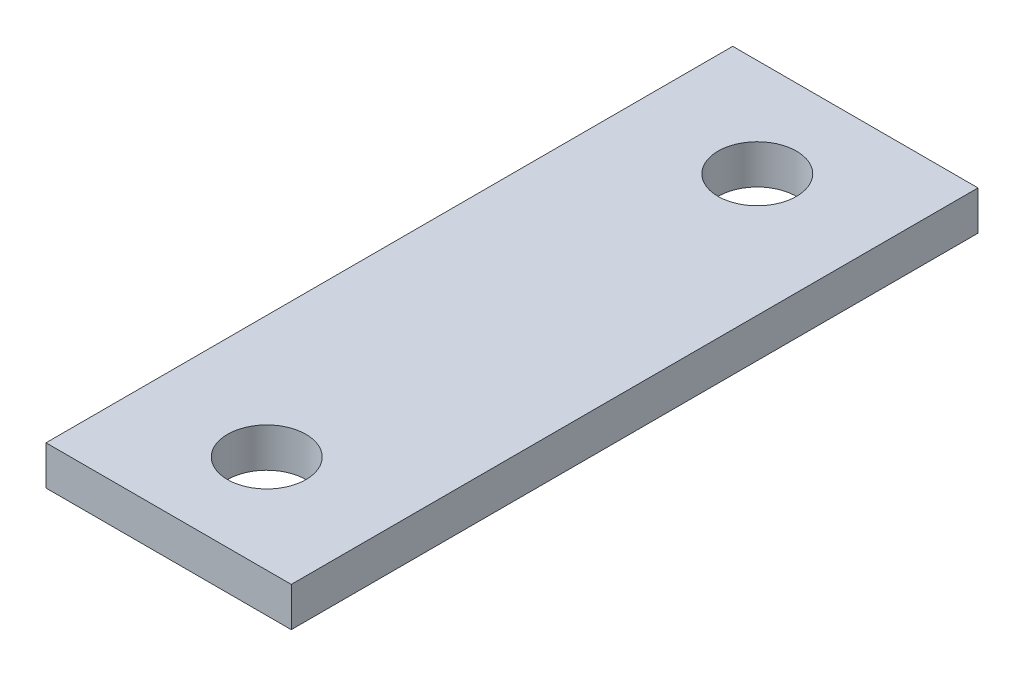
from build123d import *

# Parameters (mm, degrees)
SKETCH1_W           = 25
SKETCH1_H           = 70
BOSS_EXTRUDE1_DEPTH = 4
SKETCH2_R           = 4
CUT_EXTRUDE1_DEPTH  = 75.437893576


with BuildPart() as part:
    # Sketch1 → Boss-Extrude1 (new body)
    with BuildSketch(Plane(origin=(0, 0, 0), x_dir=(1, 0, 0), z_dir=(0, 1, 0))):
        with Locations((12.5, 35)):
            Rectangle(SKETCH1_W, SKETCH1_H)
    extrude(amount=BOSS_EXTRUDE1_DEPTH)

    # Sketch2 → Cut-Extrude1 (cut, through all)
    with BuildSketch(Plane(origin=(0, 4, 0), x_dir=(1, 0, 0), z_dir=(0, 1, 0))):
        with Locations(Location((12.5, 60, 0), (0, 0, 270))):
            Circle(SKETCH2_R)
        with Locations(Location((12.5, 10, 0), (0, 0, 270))):
            Circle(SKETCH2_R)
    extrude(amount=-CUT_EXTRUDE1_DEPTH, mode=Mode.SUBTRACT)


solid = part.part
